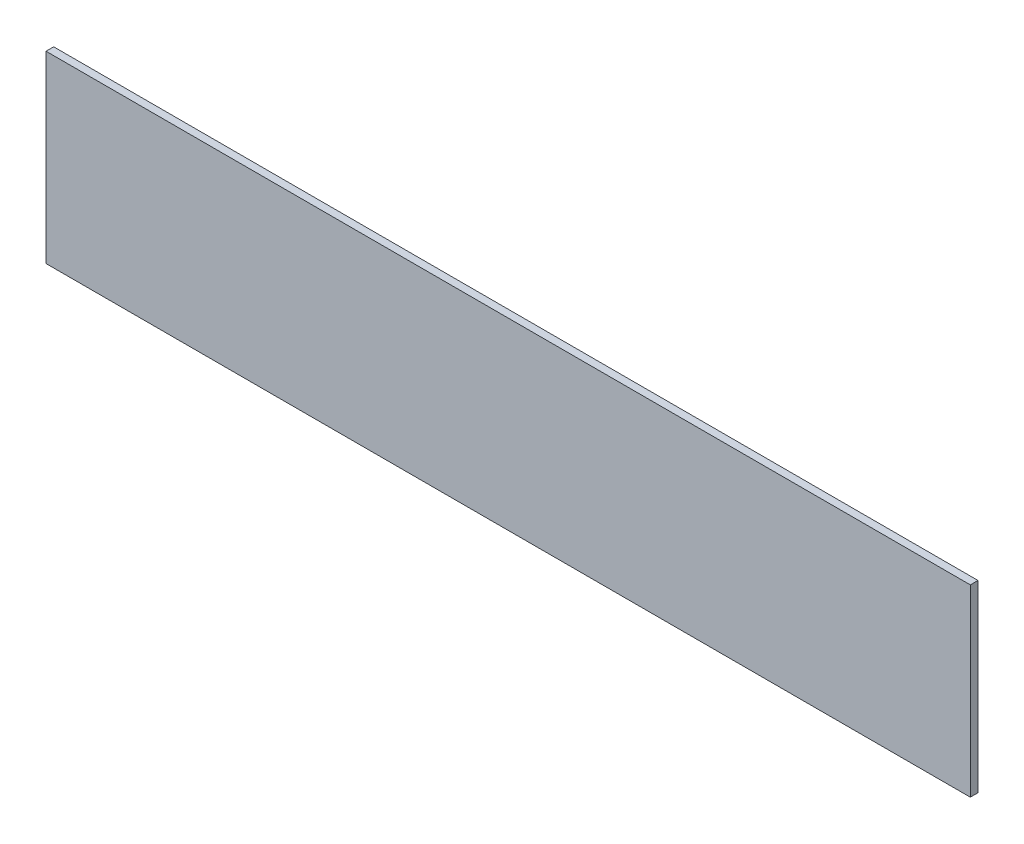
from build123d import *

# Parameters (mm, degrees)
SKETCH1_W           = 383.0066
SKETCH1_H           = 76.2
BOSS_EXTRUDE1_DEPTH = 3.175


with BuildPart() as part:
    # Sketch1 → Boss-Extrude1 (new body)
    with BuildSketch(Plane.XY):
        with Locations((191.5033, 38.1)):
            Rectangle(SKETCH1_W, SKETCH1_H)
    extrude(amount=BOSS_EXTRUDE1_DEPTH)


solid = part.part
